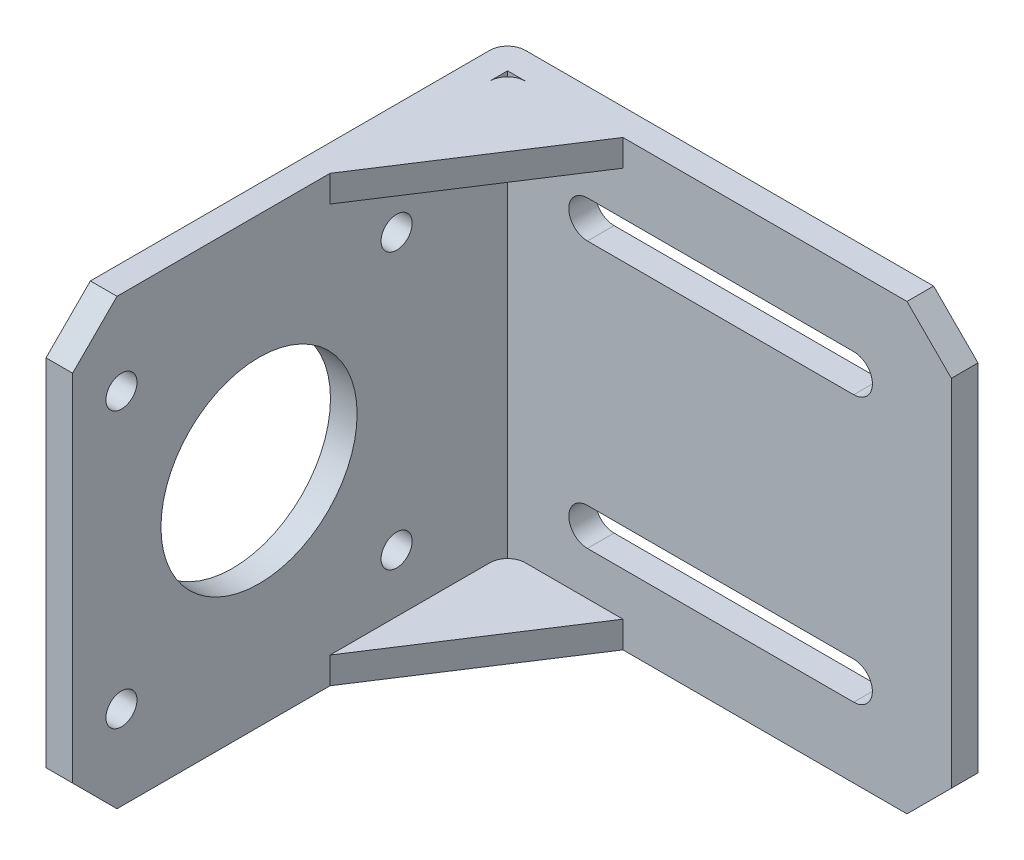
from build123d import *

# Parameters (mm, degrees)
SKETCH_1_W      = 53
SKETCH_1_H      = 50
EXTRUDE_1_DEPTH = 3
SKETCH_2_W      = 49
SKETCH_2_H      = 50
SKETCH_2_R      = 11.05
SKETCH_2_R_2    = 1.75
EXTRUDE_2_DEPTH = 3
CHAMFER_1_SIZE  = 5
EXTRUDE_3_DEPTH = 3
FILLET_1_R      = 2


with BuildPart() as part:
    # 草图1 → 凸台-拉伸1 (new body)
    with BuildSketch(Plane.XY):
        Rectangle(SKETCH_1_W, SKETCH_1_H)
        with BuildLine():
            Line((-14.5, 17.103323548), (15.5, 17.103323548))
            ThreePointArc((15.5, 17.103323548), (17.603323548, 15), (15.5, 12.896676452))
            Line((15.5, 12.896676452), (-14.5, 12.896676452))
            ThreePointArc((-14.5, 12.896676452), (-16.603323548, 15), (-14.5, 17.103323548))
        make_face(mode=Mode.SUBTRACT)
        with BuildLine():
            Line((-14.5, -12.9), (15.5, -12.9))
            ThreePointArc((15.5, -12.9), (17.6, -15), (15.5, -17.1))
            Line((15.5, -17.1), (-14.5, -17.1))
            ThreePointArc((-14.5, -17.1), (-16.6, -15), (-14.5, -12.9))
        make_face(mode=Mode.SUBTRACT)
    extrude(amount=EXTRUDE_1_DEPTH)

    # 草图2 → 凸台-拉伸2 (add)
    with BuildSketch(Plane.ZY.offset(26.5)):
        with Locations((27.5, 0)):
            Rectangle(SKETCH_2_W, SKETCH_2_H)
        with Locations((31, 0)):
            Circle(SKETCH_2_R, mode=Mode.SUBTRACT)
        with Locations((46.5, 15.5)):
            Circle(SKETCH_2_R_2, mode=Mode.SUBTRACT)
        with Locations((46.5, -15.5)):
            Circle(SKETCH_2_R_2, mode=Mode.SUBTRACT)
        with Locations((15.5, -15.5)):
            Circle(SKETCH_2_R_2, mode=Mode.SUBTRACT)
        with Locations((15.5, 15.5)):
            Circle(SKETCH_2_R_2, mode=Mode.SUBTRACT)
    extrude(amount=-EXTRUDE_2_DEPTH)

    # 倒角1
    chamfer_1_edges = [part.edges().sort_by_distance(p)[0] for p in [
        (-25, 25, 52),
        (-25, -25, 52),
        (26.5, 25, 1.5),
        (26.5, -25, 1.5),
    ]]
    chamfer(chamfer_1_edges, length=CHAMFER_1_SIZE)

    # 草图3 → 凸台-拉伸3 (add)
    with BuildSketch(Plane.XZ.offset(25)):
        with BuildLine():
            Line((-23.5, 5), (-23.5, 23))
            Line((-23.5, 23), (-10.5, 3))
            Line((-10.5, 3), (-21.5, 3))
            ThreePointArc((-21.5, 3), (-22.914213562, 3.585786438), (-23.5, 5))
        make_face()
    extrude_3 = extrude(amount=-EXTRUDE_3_DEPTH)

    # 圆角1
    fillet_1_edges = [part.edges().sort_by_distance(p)[0] for p in [
        (-26.5, 0, 0),
    ]]
    fillet(fillet_1_edges, radius=FILLET_1_R)

    # 镜向1: 凸台-拉伸3 across plane
    add(extrude_3.mirror(Plane.ZX))


solid = part.part
